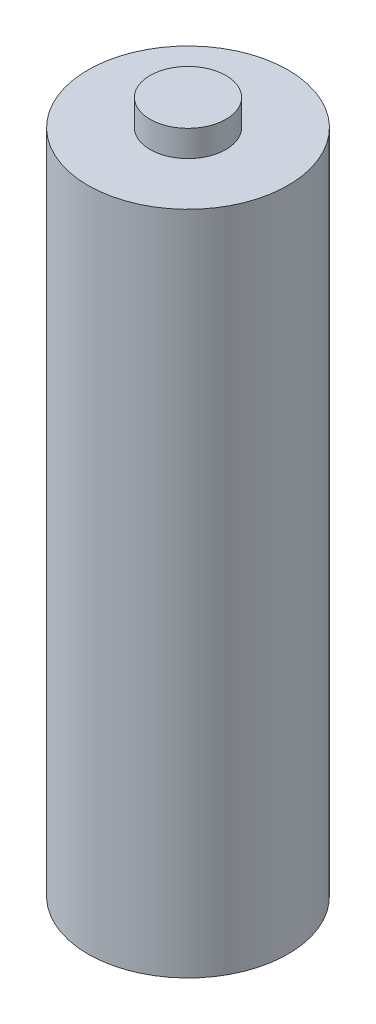
from build123d import *


with BuildPart() as part:
    # Sketch1 → Revolve1 (revolve)
    with BuildSketch(Plane.XY, mode=Mode.PRIVATE) as revolve1_sk:
        Polygon((0, 50.4), (2.75, 50.4), (2.75, 48.5), (7.25, 48.5), (7.25, 0.25), (4.7, 0.25), (4.7, 0), (0, 0), align=None)
    revolve(revolve1_sk.sketch.rotate(Axis((0, 0, 0), (0, 1, 0)), 90), axis=Axis((0, 0, 0), (0, 1, 0)))


solid = part.part
